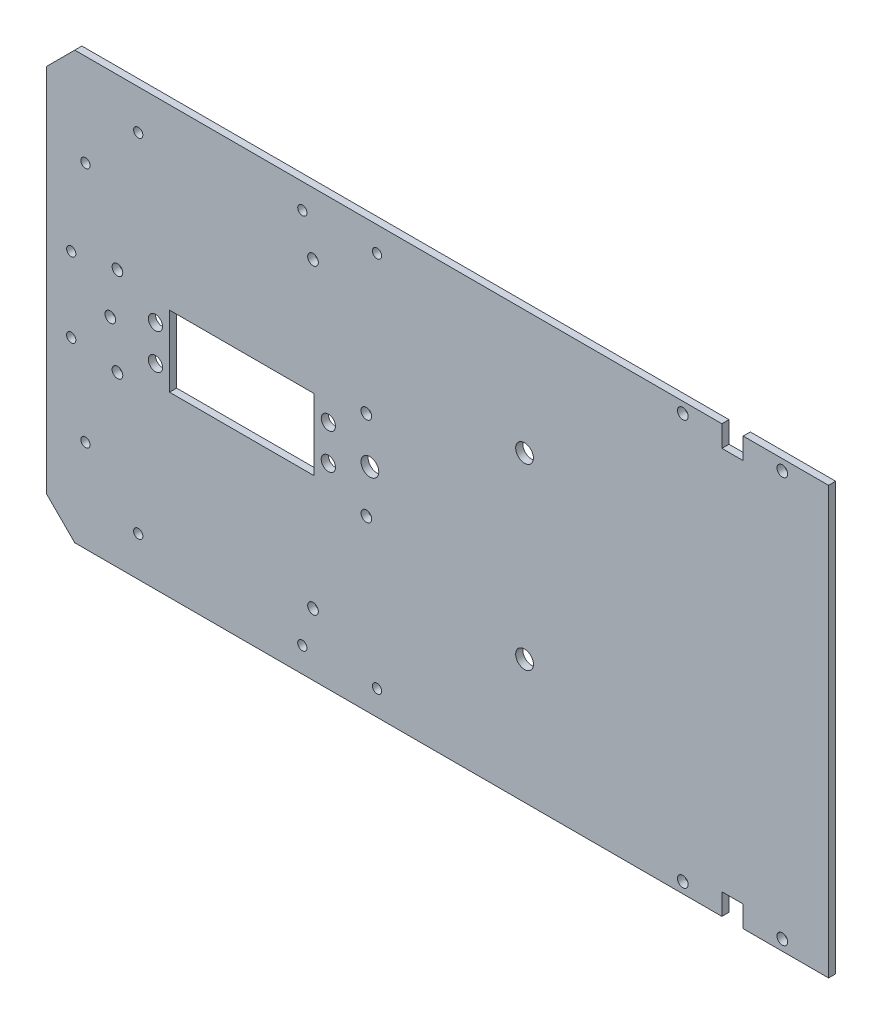
from build123d import *

# Parameters (mm, degrees)
SKETCH_5_W           = 220
SKETCH_5_H           = 120
EXTRUDE_2_DEPTH      = 2
SKETCH_6_R           = 2.5
CUT_EXTRUDE_3_DEPTH  = 126.315601583
SKETCH_7_R           = 1.5
SKETCH_7_W           = 6
SKETCH_7_H           = 6
CUT_EXTRUDE_4_DEPTH  = 126.315601583
SKETCH_9_R           = 2
SKETCH_9_W           = 40.7
SKETCH_9_H           = 20
CUT_EXTRUDE_6_DEPTH  = 126.315601583
SKETCH_13_R          = 1.3
CUT_EXTRUDE_10_DEPTH = 126.315601583
CHAMFER_1_SIZE       = 8
SKETCH_15_R          = 1.3
CUT_EXTRUDE_12_DEPTH = 126.315601583
SKETCH_16_R          = 1.3
CUT_EXTRUDE_13_DEPTH = 126.315601583
SKETCH_17_R          = 1.5
CUT_EXTRUDE_14_DEPTH = 126.315601583
SKETCH_19_R          = 1.5
CUT_EXTRUDE_15_DEPTH = 126.315601583


with BuildPart() as part:
    # 草图5 → 凸台-拉伸2 (new body)
    with BuildSketch(Plane.XY):
        Rectangle(SKETCH_5_W, SKETCH_5_H)
    extrude(amount=EXTRUDE_2_DEPTH)

    # 草图6 → 切除-拉伸3 (cut, through all)
    with BuildSketch(Plane.XY.offset(2)):
        with Locations((-19, 0)):
            Circle(SKETCH_6_R)
        with Locations((24.5, 25.11473671)):
            Circle(SKETCH_6_R)
        with Locations((24.5, -25.11473671)):
            Circle(SKETCH_6_R)
    extrude(amount=-CUT_EXTRUDE_3_DEPTH, mode=Mode.SUBTRACT)

    # 草图7 → 切除-拉伸4 (cut, through all)
    with BuildSketch(Plane.XY.offset(2)):
        with Locations((69, 57)):
            Circle(SKETCH_7_R)
        with Locations(Location((97, 57, 0), (0, 0, 180))):
            Circle(SKETCH_7_R)
        with Locations((97, -57)):
            Circle(SKETCH_7_R)
        with Locations(Location((69, -57, 0), (0, 0, 180))):
            Circle(SKETCH_7_R)
        with Locations((83, 57)):
            Rectangle(SKETCH_7_W, SKETCH_7_H)
        with Locations((83, -57)):
            Rectangle(SKETCH_7_W, SKETCH_7_H)
    extrude(amount=-CUT_EXTRUDE_4_DEPTH, mode=Mode.SUBTRACT)

    # 草图9 → 切除-拉伸6 (cut, through all)
    with BuildSketch(Plane.XY.offset(2)):
        with Locations((-79.315, 5)):
            Circle(SKETCH_9_R)
        with Locations(Location((-79.315, -5, 0), (0, 0, 180))):
            Circle(SKETCH_9_R)
        with Locations((-30.685, -5)):
            Circle(SKETCH_9_R)
        with Locations(Location((-30.685, 5, 0), (0, 0, 180))):
            Circle(SKETCH_9_R)
        with Locations((-55, 0)):
            Rectangle(SKETCH_9_W, SKETCH_9_H)
    extrude(amount=-CUT_EXTRUDE_6_DEPTH, mode=Mode.SUBTRACT)

    # 草图13 → 切除-拉伸10 (cut, through all)
    with BuildSketch(Plane.XY.offset(2)):
        with Locations((-103, 10.5)):
            Circle(SKETCH_13_R)
        with Locations(Location((-103, -10.5, 0), (0, 0, 180))):
            Circle(SKETCH_13_R)
    extrude(amount=-CUT_EXTRUDE_10_DEPTH, mode=Mode.SUBTRACT)

    # 倒角1
    chamfer_1_edges = [part.edges().sort_by_distance(p)[0] for p in [
        (-110, -60, 1),
        (-110, 60, 1),
    ]]
    chamfer(chamfer_1_edges, length=CHAMFER_1_SIZE)

    # 草图15 → 切除-拉伸12 (cut, through all)
    with BuildSketch(Plane.XY.offset(2)):
        with Locations((-38, 53)):
            Circle(SKETCH_15_R)
        with Locations(Location((-38, -53, 0), (0, 0, 180))):
            Circle(SKETCH_15_R)
        with Locations((-17, 53)):
            Circle(SKETCH_15_R)
        with Locations(Location((-17, -53, 0), (0, 0, 180))):
            Circle(SKETCH_15_R)
    extrude(amount=-CUT_EXTRUDE_12_DEPTH, mode=Mode.SUBTRACT)

    # 草图16 → 切除-拉伸13 (cut, through all)
    with BuildSketch(Plane.XY.offset(2)):
        with Locations((-99, 34)):
            Circle(SKETCH_16_R)
        with Locations((-84.150757595, 48.849242405)):
            Circle(SKETCH_16_R)
        with Locations(Location((-99, -34, 0), (0, 0, 180))):
            Circle(SKETCH_16_R)
        with Locations(Location((-84.150757595, -48.849242405, 0), (0, 0, 180))):
            Circle(SKETCH_16_R)
    extrude(amount=-CUT_EXTRUDE_13_DEPTH, mode=Mode.SUBTRACT)

    # 草图17 → 切除-拉伸14 (cut, through all)
    with BuildSketch(Plane.XY.offset(2)):
        with Locations((-20, 12.5)):
            Circle(SKETCH_17_R)
        with Locations(Location((-20, -12.5, 0), (0, 0, 180))):
            Circle(SKETCH_17_R)
        with Locations((-90, 12.5)):
            Circle(SKETCH_17_R)
        with Locations(Location((-90, -12.5, 0), (0, 0, 180))):
            Circle(SKETCH_17_R)
    extrude(amount=-CUT_EXTRUDE_14_DEPTH, mode=Mode.SUBTRACT)

    # 草图19 → 切除-拉伸15 (cut, through all)
    with BuildSketch(Plane.XY.offset(2)):
        with Locations((-92, 0)):
            Circle(SKETCH_19_R)
        with Locations((-35, 42.5)):
            Circle(SKETCH_19_R)
        with Locations(Location((-35, -42.5, 0), (0, 0, 180))):
            Circle(SKETCH_19_R)
    extrude(amount=-CUT_EXTRUDE_15_DEPTH, mode=Mode.SUBTRACT)


solid = part.part
